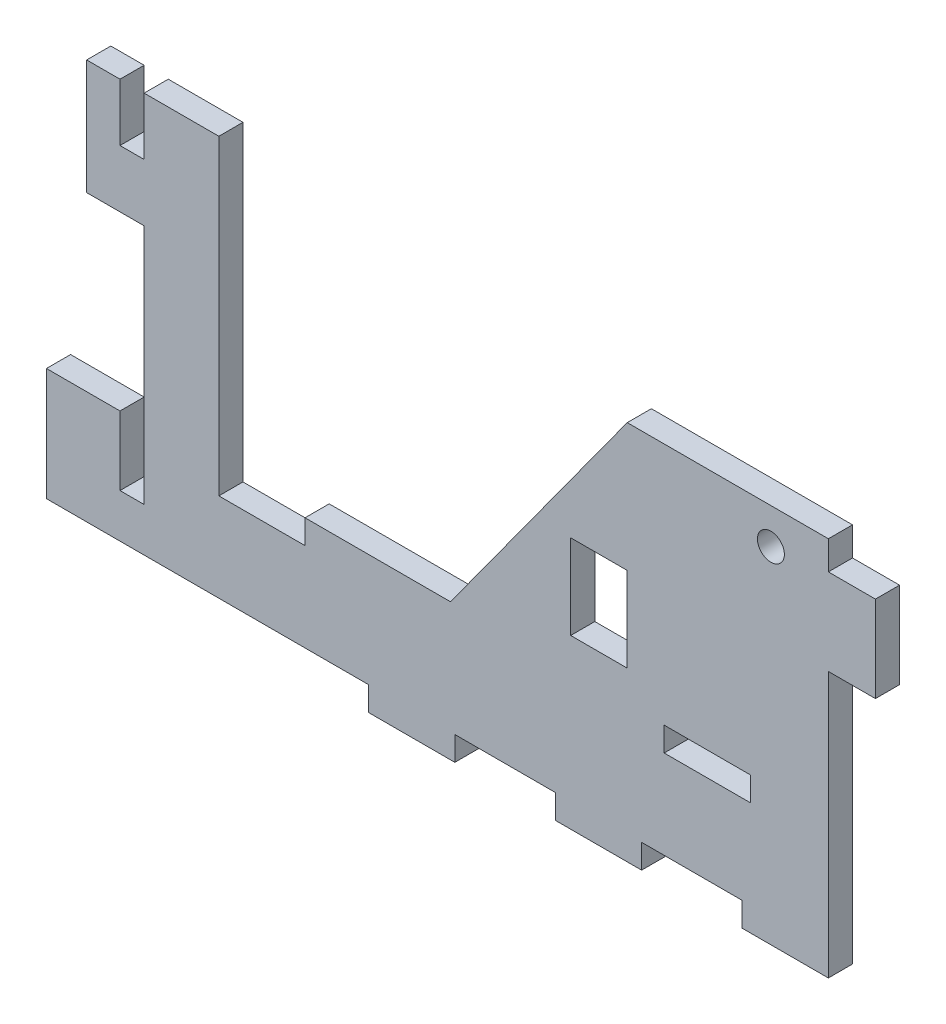
from build123d import *

# Parameters (mm, degrees)
SKETCH2_W                   = 101.6
SKETCH2_H                   = 78.74
SQUARE_DEPTH                = 5.334
SKETCH4_R                   = 2.975000019
SKETCH4_W                   = 19.05
SKETCH4_H                   = 5.334
MOUNTING_POINTS_DEPTH       = 65.490995154
TRICUT_DEPTH                = 65.490995154
TRICUT_DEPTH_BACK           = 65.490995154
SKETCH5_W                   = 19.05
SKETCH5_H                   = 5.334
BOTTOMTEETH_DEPTH           = 5.334
SKETCH8_W                   = 5.334
SKETCH8_H                   = 19.05
GRABBERSTOP_DEPTH           = 10.4
UNOPLATFORM_DEPTH           = 5.334
SKETCH13_W                  = 19.05
SKETCH13_H                  = 5.334
BACKTOOTH_DEPTH             = 5.334
SKETCH14_W                  = 5.334
SKETCH14_H                  = 24.923365698
CIRCUITSTACKEXTENSION_DEPTH = 25.4
SKETCH16_W                  = 5.334
SKETCH16_H                  = 15.24
CIRCUITSTACKHOLDER_DEPTH    = 131.051294604
SKETCH17_W                  = 16.51
SKETCH17_H                  = 5.334
BRACES_DEPTH                = 63.5
SKETCH18_W                  = 5.334
SKETCH18_H                  = 12.7
BRACE2_DEPTH                = 12.7
SKETCH19_W                  = 7.366
SKETCH19_H                  = 5.334
BRACE3_DEPTH                = 12.7
SKETCH20_W                  = 12.499999892
SKETCH20_H                  = 18.7
ON_OFF_SWITCH_DEPTH         = 132.609742414


with BuildPart() as part:
    # Sketch2 → square (new body)
    with BuildSketch(Plane.XY):
        Rectangle(SKETCH2_W, SKETCH2_H)
    extrude(amount=SQUARE_DEPTH)

    # Sketch4 → Mounting points (cut, through all)
    with BuildSketch(Plane.XY.offset(5.334)):
        with Locations((38.1, 31.496)):
            Circle(SKETCH4_R)
        with Locations((24.040000053, -17.113634263)):
            Rectangle(SKETCH4_W, SKETCH4_H)
    extrude(amount=-MOUNTING_POINTS_DEPTH, mode=Mode.SUBTRACT)

    # Sketch3 → tricut (cut, two sides: drawn at the far end of the back side and taken through both)
    with BuildSketch(Plane.XY.offset(5.334).offset(-TRICUT_DEPTH_BACK)):
        Polygon((-207.681606875, -255.517991695), (-50.8, -39.37), (6.35, 39.37), (50.8, 39.37), (317.880124475, 39.37), (56.500793408, 505.211192735), (-469.060937942, 210.323201041), align=None)
    extrude(amount=TRICUT_DEPTH + TRICUT_DEPTH_BACK, mode=Mode.SUBTRACT)

    # Sketch5 → bottomTeeth (add)
    with BuildSketch(Plane.XZ.offset(39.37)):
        with Locations((-41.275, 2.667)):
            Rectangle(SKETCH5_W, SKETCH5_H)
        with Locations((0, 2.667)):
            Rectangle(SKETCH5_W, SKETCH5_H)
        with Locations((41.275, 2.667)):
            Rectangle(SKETCH5_W, SKETCH5_H)
    extrude(amount=BOTTOMTEETH_DEPTH)

    # Sketch8 → GrabberStop (add)
    with BuildSketch(Plane(origin=(50.8, 0, 0), x_dir=(0, 0, -1), z_dir=(1, 0, 0))):
        with Locations((-2.667, 23.495)):
            Rectangle(SKETCH8_W, SKETCH8_H)
    extrude(amount=GRABBERSTOP_DEPTH)

    # Sketch9 → UnoPlatform (add)
    with BuildSketch(Plane.XY.offset(5.334)):
        Polygon((-96.60999982, -39.37), (-50.8, -39.37), (-32.71046038, -14.446634302), (-96.60999982, -14.446634302), align=None)
    extrude(amount=-UNOPLATFORM_DEPTH)

    # Sketch13 → backTooth (cut)
    with BuildSketch(Plane(origin=(0, -14.446634302, 0), x_dir=(1, 0, 0), z_dir=(0, 1, 0))):
        with Locations((-74.38499982, -2.667)):
            Rectangle(SKETCH13_W, SKETCH13_H)
    extrude(amount=-BACKTOOTH_DEPTH, mode=Mode.SUBTRACT)

    # Sketch14 → CircuitStackExtension (add)
    with BuildSketch(Plane.ZY.offset(96.60999982)):
        with Locations((2.667, -26.908317151)):
            Rectangle(SKETCH14_W, SKETCH14_H)
    extrude(amount=CIRCUITSTACKEXTENSION_DEPTH)

    # Sketch16 → CircuitStackHolder (cut, through all)
    with BuildSketch(Plane.XY.offset(5.334)):
        with Locations((-103.08699982, -22.066634302)):
            Rectangle(SKETCH16_W, SKETCH16_H)
    extrude(amount=-CIRCUITSTACKHOLDER_DEPTH, mode=Mode.SUBTRACT)

    # Sketch17 → Braces (add)
    with BuildSketch(Plane(origin=(0, -14.446634302, 0), x_dir=(1, 0, 0), z_dir=(0, 1, 0))):
        with Locations((-92.16499982, -2.667)):
            Rectangle(SKETCH17_W, SKETCH17_H)
    extrude(amount=BRACES_DEPTH)

    # Sketch18 → Brace2 (add)
    with BuildSketch(Plane.ZY.offset(100.41999982)):
        with Locations((2.667, 30.003365698)):
            Rectangle(SKETCH18_W, SKETCH18_H)
    extrude(amount=BRACE2_DEPTH)

    # Sketch19 → Brace3 (add)
    with BuildSketch(Plane(origin=(0, 36.353365698, 0), x_dir=(1, 0, 0), z_dir=(0, 1, 0))):
        with Locations((-109.43699982, -2.667)):
            Rectangle(SKETCH19_W, SKETCH19_H)
    extrude(amount=BRACE3_DEPTH)

    # Sketch20 → On_Off Switch (cut, through all)
    with BuildSketch(Plane.XY.offset(5.334)):
        with Locations((0.100000054, 1.73)):
            Rectangle(SKETCH20_W, SKETCH20_H)
    extrude(amount=-ON_OFF_SWITCH_DEPTH, mode=Mode.SUBTRACT)


solid = part.part
